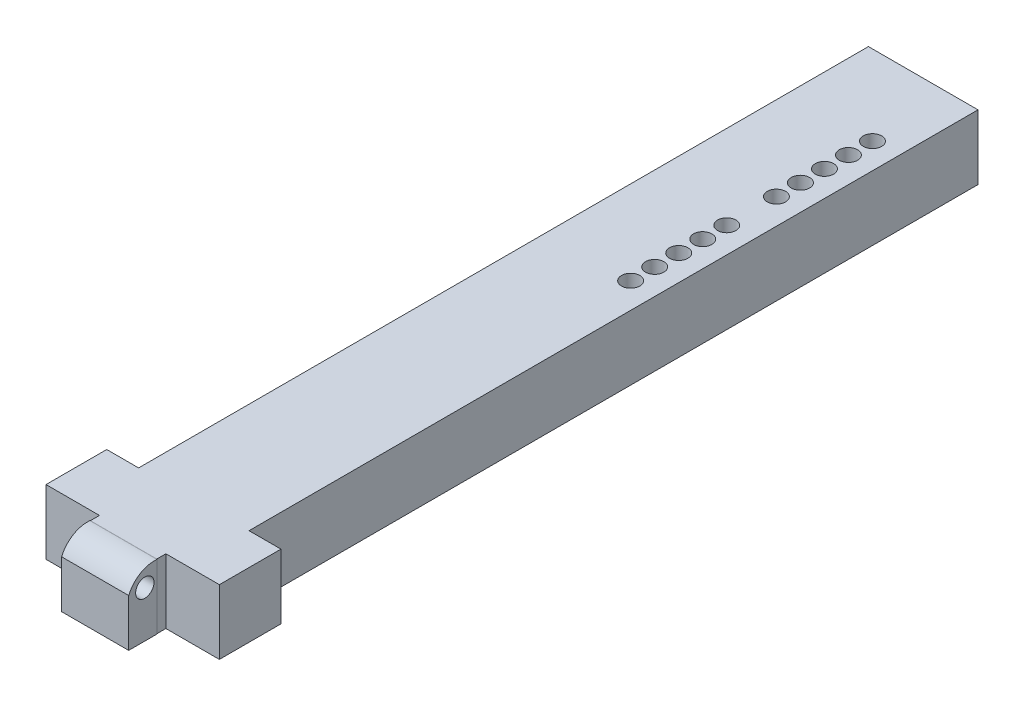
from build123d import *

# Parameters (mm, degrees)
SKETCH1_R           = 1.7
BOSS_EXTRUDE1_DEPTH = 12
SKETCH2_R           = 1.7
BOSS_EXTRUDE2_DEPTH = 6.2125


with BuildPart() as part:
    # Sketch1 → Boss-Extrude1 (new body)
    with BuildSketch(Plane(origin=(0, 0, 0), x_dir=(1, 0, 0), z_dir=(0, 1, 0))):
        Polygon((-10.15, 81.202952909), (10.15, 81.202952909), (10.15, -53.848636554), (16.06, -53.848636554), (16.06, -65.254427144), (6.15, -65.254427144), (6.15, -66.934427144), (-6.15, -66.934427144), (-6.15, -65.254427144), (-16.06, -65.254427144), (-16.06, -54.004427144), (-10.15, -54.004427144), align=None)
        with Locations(Location((5.4, 57.504034689, 0), (0, 0, 270))):
            Circle(SKETCH1_R, mode=Mode.SUBTRACT)
        with Locations(Location((5.4, 30.504034689, 0), (0, 0, 270))):
            Circle(SKETCH1_R, mode=Mode.SUBTRACT)
        with Locations(Location((5.4001, 53.054034689, 0), (0, 0, 270))):
            Circle(SKETCH1_R, mode=Mode.SUBTRACT)
        with Locations(Location((5.4001, 26.054034689, 0), (0, 0, 270))):
            Circle(SKETCH1_R, mode=Mode.SUBTRACT)
        with Locations(Location((5.4, 61.954034689, 0), (0, 0, 270))):
            Circle(SKETCH1_R, mode=Mode.SUBTRACT)
        with Locations(Location((5.39995, 34.954034689, 0), (0, 0, 270))):
            Circle(SKETCH1_R, mode=Mode.SUBTRACT)
        with Locations(Location((5.4, 48.60403469, 0), (0, 0, 270))):
            Circle(SKETCH1_R, mode=Mode.SUBTRACT)
        with Locations(Location((5.40005, 66.404034689, 0), (0, 0, 270))):
            Circle(SKETCH1_R, mode=Mode.SUBTRACT)
        with Locations(Location((5.4, 21.60403469, 0), (0, 0, 270))):
            Circle(SKETCH1_R, mode=Mode.SUBTRACT)
        with Locations(Location((5.4, 39.404034689, 0), (0, 0, 270))):
            Circle(SKETCH1_R, mode=Mode.SUBTRACT)
    extrude(amount=BOSS_EXTRUDE1_DEPTH)

    # Sketch2 → Boss-Extrude2 (add, symmetric)
    with BuildSketch(Plane(origin=(0, 0, 0), x_dir=(0, 0, -1), z_dir=(1, 0, 0))):
        with BuildLine():
            Line((-72.207292933, 5.999665069), (-72.207292933, 8.809665069))
            ThreePointArc((-72.207292933, 8.809665069), (-70.110812417, 11.254776949), (-66.977292933, 11.999665069))
            Line((-66.977292933, 11.999665069), (-66.934427144, 12))
            Line((-66.934427144, 12), (-66.934427144, 0))
            Line((-66.934427144, 0), (-72.207292933, 0))
            Line((-72.207292933, 0), (-72.207292933, 5.999665069))
        make_face()
        with Locations((-69.217292933, 8.579665069)):
            Circle(SKETCH2_R, mode=Mode.SUBTRACT)
    extrude(amount=BOSS_EXTRUDE2_DEPTH, both=True)


solid = part.part
